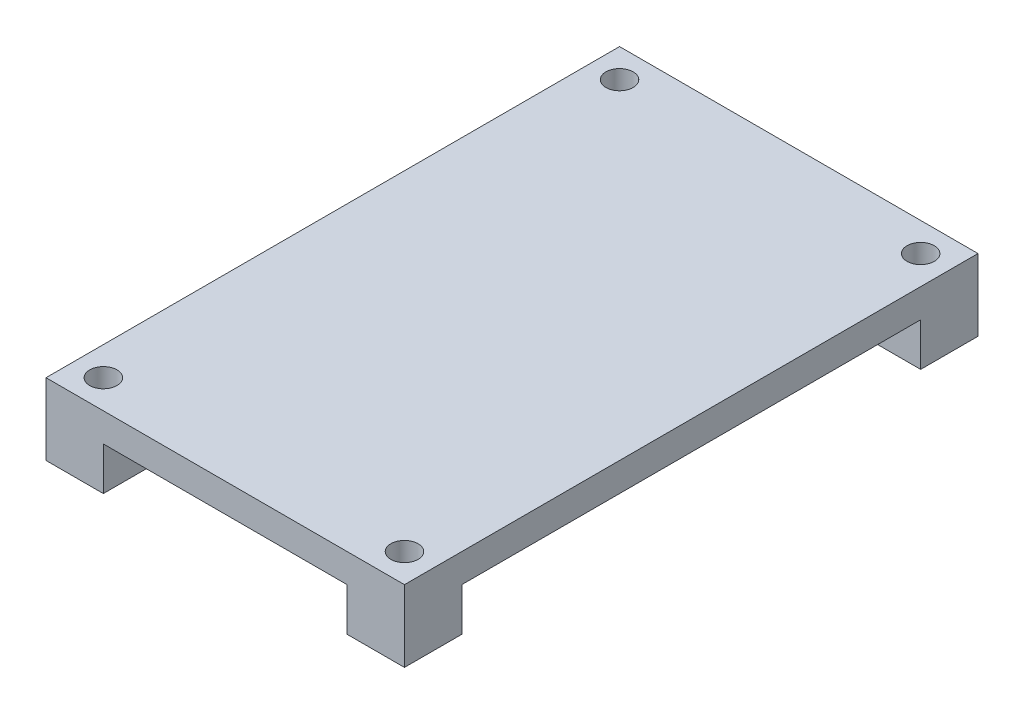
from build123d import *

# Parameters (mm, degrees)
SKETCH1_W           = 25
SKETCH1_H           = 40
SKETCH1_R           = 0.95
BOSS_EXTRUDE1_DEPTH = 2
BOSS_EXTRUDE2_START = 3
SKETCH2_W           = 4
SKETCH2_H           = 4
SKETCH2_R           = 0.95
BOSS_EXTRUDE2_DEPTH = 3


with BuildPart() as part:
    # Sketch1 → Boss-Extrude1 (new body)
    with BuildSketch(Plane(origin=(0, 0, 0), x_dir=(1, 0, 0), z_dir=(0, 1, 0))):
        Rectangle(SKETCH1_W, SKETCH1_H)
        with Locations(Location((-10.5, 18, 0), (0, 0, 270))):
            Circle(SKETCH1_R, mode=Mode.SUBTRACT)
        with Locations(Location((10.5, 18, 0), (0, 0, 90))):
            Circle(SKETCH1_R, mode=Mode.SUBTRACT)
        with Locations(Location((-10.5, -18, 0), (0, 0, 90))):
            Circle(SKETCH1_R, mode=Mode.SUBTRACT)
        with Locations(Location((10.5, -18, 0), (0, 0, 270))):
            Circle(SKETCH1_R, mode=Mode.SUBTRACT)
    extrude(amount=BOSS_EXTRUDE1_DEPTH)

    # Sketch2 → Boss-Extrude2 (add)
    # profile 1 of 4: a face of its own
    with BuildSketch(Plane(origin=(0, 0, 0), x_dir=(-1, 0, 0), z_dir=(0, -1, 0)).offset(BOSS_EXTRUDE2_START)):
        with Locations((-10.5, 18)):
            Rectangle(SKETCH2_W, SKETCH2_H)
        with Locations(Location((-10.5, 18, 0), (0, 0, 90))):
            Circle(SKETCH2_R, mode=Mode.SUBTRACT)
    # profile 2 of 4: a face of its own
    with BuildSketch(Plane(origin=(0, 0, 0), x_dir=(-1, 0, 0), z_dir=(0, -1, 0)).offset(BOSS_EXTRUDE2_START)):
        with Locations((10.5, 18)):
            Rectangle(SKETCH2_W, SKETCH2_H)
        with Locations(Location((10.5, 18, 0), (0, 0, 270))):
            Circle(SKETCH2_R, mode=Mode.SUBTRACT)
    # profile 3 of 4: a face of its own
    with BuildSketch(Plane(origin=(0, 0, 0), x_dir=(-1, 0, 0), z_dir=(0, -1, 0)).offset(BOSS_EXTRUDE2_START)):
        with Locations((-10.5, -18)):
            Rectangle(SKETCH2_W, SKETCH2_H)
        with Locations(Location((-10.5, -18, 0), (0, 0, 270))):
            Circle(SKETCH2_R, mode=Mode.SUBTRACT)
    # profile 4 of 4: a face of its own
    with BuildSketch(Plane(origin=(0, 0, 0), x_dir=(-1, 0, 0), z_dir=(0, -1, 0)).offset(BOSS_EXTRUDE2_START)):
        with Locations((10.5, -18)):
            Rectangle(SKETCH2_W, SKETCH2_H)
        with Locations(Location((10.5, -18, 0), (0, 0, 90))):
            Circle(SKETCH2_R, mode=Mode.SUBTRACT)
    extrude(amount=-BOSS_EXTRUDE2_DEPTH)


solid = part.part
